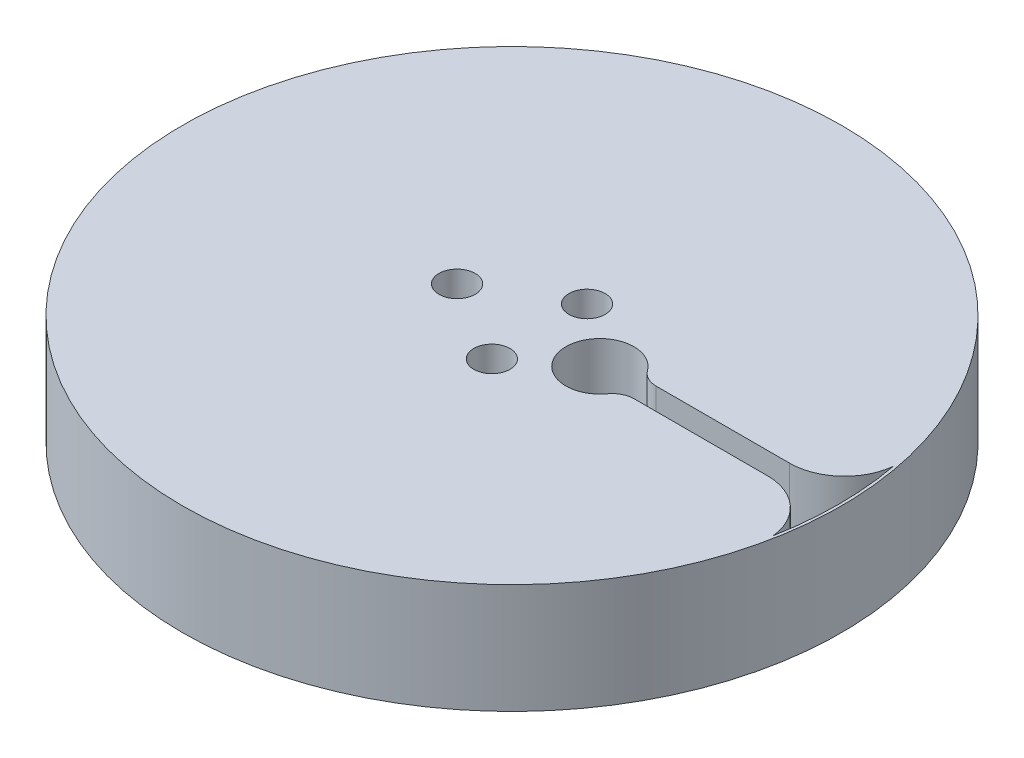
from build123d import *

# Parameters (mm, degrees)
SKETCH_1_R          = 30
EXTRUDE_1_DEPTH     = 10
CUT_EXTRUDE_1_DEPTH = 10
FILLET_1_R          = 2
FILLET_2_R          = 5
SKETCH_3_R          = 1.65
CUT_EXTRUDE_2_DEPTH = 10
SKETCH_4_R          = 30
SKETCH_4_R_2        = 29.75
EXTRUDE_2_DEPTH     = 10


with BuildPart() as part:
    # 草图1 → 凸台-拉伸1 (new body)
    with BuildSketch(Plane(origin=(0, 0, 0), x_dir=(1, 0, 0), z_dir=(0, 1, 0))):
        with Locations(Location((0, 0, 0), (0, 0, 270))):
            Circle(SKETCH_1_R)
    extrude(amount=EXTRUDE_1_DEPTH)

    # 草图2 → 切除-拉伸1 (cut)
    with BuildSketch(Plane.XZ):
        with BuildLine():
            Line((10.93428015, 1), (30.93428015, 1))
            Line((30.93428015, 1), (30.93428015, -1))
            Line((30.93428015, -1), (10.93428015, -1))
            ThreePointArc((10.93428015, -1), (4.9, 0), (10.93428015, 1))
        make_face()
    extrude(amount=-CUT_EXTRUDE_1_DEPTH, mode=Mode.SUBTRACT)

    # 圆角1
    fillet_1_edges = [part.edges().sort_by_distance(p)[0] for p in [
        (10.93428015, 5, 1),
        (10.93428015, 5, -1),
    ]]
    fillet(fillet_1_edges, radius=FILLET_1_R)

    # 圆角2
    fillet_2_edges = [part.edges().sort_by_distance(p)[0] for p in [
        (29.983328701, 5, 1),
        (29.983328701, 5, -1),
    ]]
    fillet(fillet_2_edges, radius=FILLET_2_R)

    # 草图3 → 切除-拉伸2 (cut)
    with BuildSketch(Plane.XZ):
        with Locations(Location((-5, 0, 0), (0, 0, 270))):
            Circle(SKETCH_3_R)
        with Locations(Location((2.5, 4.330127019, 0), (0, 0, 270))):
            Circle(SKETCH_3_R)
        with Locations(Location((2.5, -4.330127019, 0), (0, 0, 270))):
            Circle(SKETCH_3_R)
    extrude(amount=-CUT_EXTRUDE_2_DEPTH, mode=Mode.SUBTRACT)

    # 草图4 → 凸台-拉伸2 (add)
    with BuildSketch(Plane.XZ):
        with Locations(Location((0, 0, 0), (0, 0, 90))):
            Circle(SKETCH_4_R)
        Circle(SKETCH_4_R_2, mode=Mode.SUBTRACT)
    extrude(amount=-EXTRUDE_2_DEPTH)


solid = part.part
